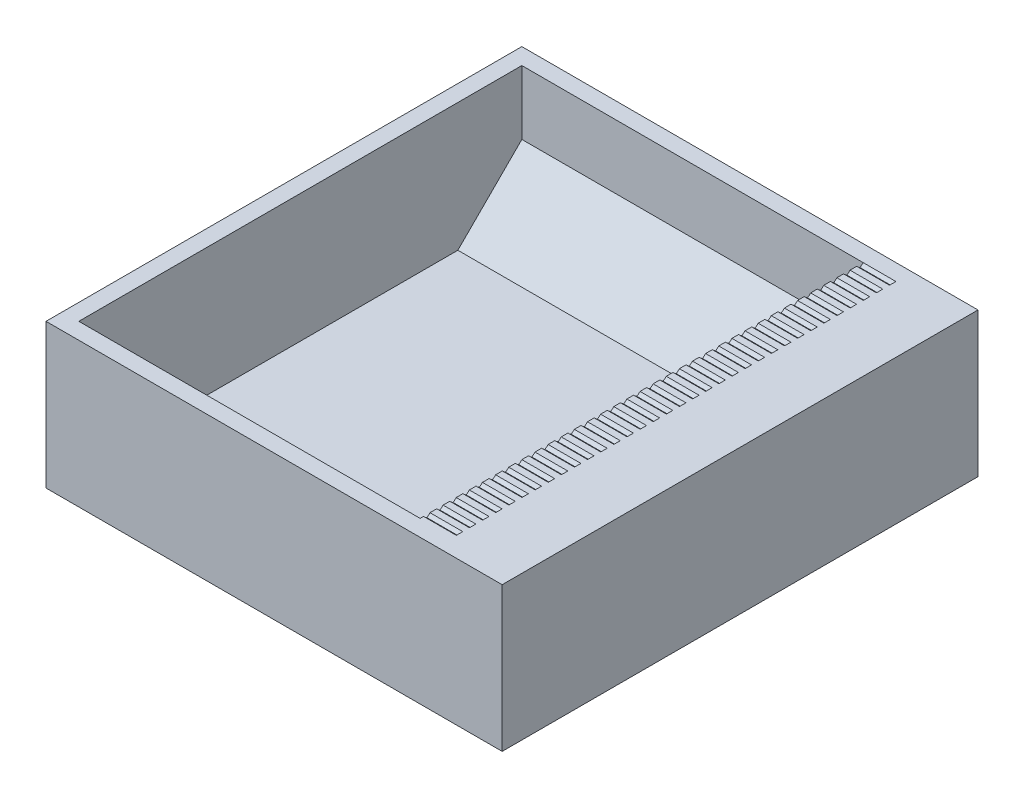
from build123d import *

# Parameters (mm, degrees)
SKETCH_1_W                 = 145
SKETCH_1_H                 = 44
EXTRUDE_1_DEPTH            = 139
SHELL_1_T                  = -5
SHELL_1_THICKNESS_2_FACE_W = 135
SHELL_1_THICKNESS_2_FACE_H = 39
SHELL_1_THICKNESS_2_DEPTH  = 25
EXTRUDE_2_REACH            = 204.28
CUT_EXTRUDE_START          = -10
CUT_EXTRUDE_1_DEPTH        = 10
PATTERN_LINEAR_2_COUNT     = 34
PATTERN_LINEAR_2_PITCH     = 4


with BuildPart() as part:
    # 스케치1 → 보스-돌출1 (new body)
    with BuildSketch(Plane(origin=(0, 0, 0), x_dir=(0, 0, -1), z_dir=(1, 0, 0))):
        with Locations((-72.5, 22)):
            Rectangle(SKETCH_1_W, SKETCH_1_H)
    extrude(amount=EXTRUDE_1_DEPTH)

    # 쉘1
    shell_1_openings = [part.faces().sort_by_distance(p)[0] for p in [
        (69.5, 44, 72.5),
    ]]
    offset(amount=SHELL_1_T, openings=shell_1_openings, kind=Kind.INTERSECTION)

    # 쉘1 thickness 2 face (on inner face of the shell) → 쉘1 thickness 2 (add)
    with BuildSketch(Plane(origin=(134, 24.5, 72.5), x_dir=(0, 0, 1), z_dir=(1, 0, 0))):
        Rectangle(SHELL_1_THICKNESS_2_FACE_W, SHELL_1_THICKNESS_2_FACE_H)
    extrude(amount=-SHELL_1_THICKNESS_2_DEPTH)

    # 스케치3 → 보스-돌출2 (add, up to next)
    with BuildSketch(Plane(origin=(5, 0, 0), x_dir=(0, 0, -1), z_dir=(1, 0, 0)), mode=Mode.PRIVATE) as extrude_2_sk1:
        Polygon((-5, 24.5), (-24.5, 5), (-5, 5), align=None)
    extrude_2_tool1 = extrude(extrude_2_sk1.sketch, amount=EXTRUDE_2_REACH, mode=Mode.PRIVATE) - part.part
    add(extrude_2_tool1.solids().sort_by_distance((5, 11.5, 11.5))[0])

    # 스케치4 → 컷-돌출1 (cut)
    with BuildSketch(Plane.ZY.offset(-109).offset(CUT_EXTRUDE_START)):
        with BuildLine():
            Line((4.168052643, 46.265280356), (7.789262128, 46.265280356))
            ThreePointArc((7.789262128, 46.265280356), (7.302805176, 44.485235891), (5.978657386, 43.2))
            ThreePointArc((5.978657386, 43.2), (4.654509595, 44.485235891), (4.168052643, 46.265280356))
        make_face()
    cut_extrude_1 = extrude(amount=CUT_EXTRUDE_1_DEPTH, mode=Mode.SUBTRACT)

    # 선형 패턴2: 컷-돌출1 ×34
    with Locations(*[(0, 0, i * PATTERN_LINEAR_2_PITCH) for i in range(1, PATTERN_LINEAR_2_COUNT)]):
        add(cut_extrude_1, mode=Mode.SUBTRACT)


solid = part.part
